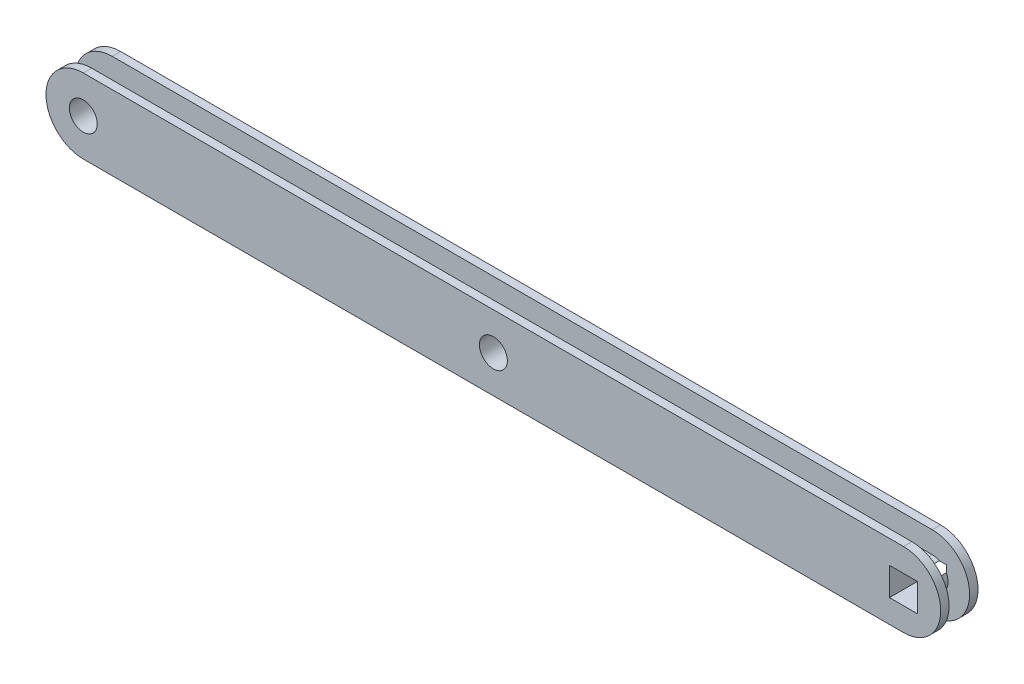
from build123d import *

# Parameters (mm, degrees)
ESQUISSE1_W             = 152.4
ESQUISSE1_H             = 12.7
BOSS_EXTRU_1_DEPTH      = 6.35
ESQUISSE2_R             = 2.38125
ENL_V_MAT_EXTRU_1_DEPTH = 154.060029074
SKETCH1_W               = 14.17076538
SKETCH1_H               = 3.495000122
CUT_REVOLVE1_ANGLE      = 180
SKETCH2_W               = 3.495000122
SKETCH2_H               = 3.683
CUT_EXTRUDE1_DEPTH      = 154.060029074


with BuildPart() as part:
    # Esquisse1 → Boss.-Extru.1 (new body)
    with BuildSketch(Plane.XY):
        with Locations((-76.2, 6.35)):
            Rectangle(ESQUISSE1_W, ESQUISSE1_H)
    extrude(amount=-BOSS_EXTRU_1_DEPTH)

    # Esquisse2 → Enlèv. mat.-Extru.1 (cut, through all)
    with BuildSketch(Plane.XY):
        with Locations((-146.05, 6.35)):
            Circle(ESQUISSE2_R)
        with Locations((-76.2, 6.35)):
            Circle(ESQUISSE2_R)
        with Locations((-6.35, 6.35)):
            Circle(ESQUISSE2_R)
        with BuildLine():
            Line((0, 12.7), (-6.35, 12.7))
            ThreePointArc((-6.35, 12.7), (-1.859871939, 10.840128061), (0, 6.35))
            Line((0, 6.35), (0, 12.7))
        make_face()
        with BuildLine():
            Line((0, 0), (0, 6.35))
            ThreePointArc((0, 6.35), (-1.859871939, 1.859871939), (-6.35, 0))
            Line((-6.35, 0), (0, 0))
        make_face()
        with BuildLine():
            ThreePointArc((-152.4, 6.35), (-150.540128061, 10.840128061), (-146.05, 12.7))
            Line((-146.05, 12.7), (-152.4, 12.7))
            Line((-152.4, 12.7), (-152.4, 6.35))
        make_face()
        with BuildLine():
            ThreePointArc((-146.05, 0), (-150.540128061, 1.859871939), (-152.4, 6.35))
            Line((-152.4, 6.35), (-152.4, 0))
            Line((-152.4, 0), (-146.05, 0))
        make_face()
        with BuildLine():
            Line((-8.73125, 8.73125), (-8.73125, 6.35))
            ThreePointArc((-8.73125, 6.35), (-8.033798023, 8.033798023), (-6.35, 8.73125))
            Line((-6.35, 8.73125), (-8.73125, 8.73125))
        make_face()
        with BuildLine():
            ThreePointArc((-6.35, 8.73125), (-4.666201977, 8.033798023), (-3.96875, 6.35))
            Line((-3.96875, 6.35), (-3.96875, 8.73125))
            Line((-3.96875, 8.73125), (-6.35, 8.73125))
        make_face()
        with BuildLine():
            ThreePointArc((-3.96875, 6.35), (-4.666201977, 4.666201977), (-6.35, 3.96875))
            Line((-6.35, 3.96875), (-3.96875, 3.96875))
            Line((-3.96875, 3.96875), (-3.96875, 6.35))
        make_face()
        with BuildLine():
            Line((-8.73125, 6.35), (-8.73125, 3.96875))
            Line((-8.73125, 3.96875), (-6.35, 3.96875))
            ThreePointArc((-6.35, 3.96875), (-8.033798023, 4.666201977), (-8.73125, 6.35))
        make_face()
    extrude(amount=-ENL_V_MAT_EXTRU_1_DEPTH, mode=Mode.SUBTRACT)

    # Sketch1 → Cut-Revolve1 (revolve, symmetric, cut)
    with BuildSketch(Plane(origin=(0, 6.35, 0), x_dir=(1, 0, 0), z_dir=(0, 1, 0))) as cut_revolve1_sk:
        Polygon((-150.5585, 1.427499939), (-152.4, 1.427499939), (-152.4, 4.922500061), (-150.5585, 4.922500061), (-148.717, 4.922500061), (-148.717, 1.427499939), align=None)
        with Locations((-159.48538269, 3.175)):
            Rectangle(SKETCH1_W, SKETCH1_H)
    cut_revolve1 = revolve(axis=Axis((-146.05, 6.35, -6.35), (0, 0, 1)), revolution_arc=CUT_REVOLVE1_ANGLE / 2, mode=Mode.SUBTRACT)
    cut_revolve1 = cut_revolve1 + revolve(cut_revolve1_sk.sketch, axis=Axis((-146.05, 6.35, -6.35), (0, 0, -1)), revolution_arc=CUT_REVOLVE1_ANGLE / 2, mode=Mode.SUBTRACT)

    # Mirror1: Cut-Revolve1 across plane
    add(cut_revolve1.mirror(Plane(origin=(-76.2, 0, 0), x_dir=(0, 0, 1), z_dir=(1, 0, 0))), mode=Mode.SUBTRACT)

    # Sketch2 → Cut-Extrude1 (cut, through all)
    with BuildSketch(Plane(origin=(0, 0, 0), x_dir=(0, 0, -1), z_dir=(1, 0, 0))):
        with Locations((3.175, 10.8585)):
            Rectangle(SKETCH2_W, SKETCH2_H)
    cut_extrude1 = extrude(amount=-CUT_EXTRUDE1_DEPTH, mode=Mode.SUBTRACT)

    # Mirror2: Cut-Extrude1 across plane
    add(cut_extrude1.mirror(Plane.ZX.offset(6.35)), mode=Mode.SUBTRACT)


solid = part.part
